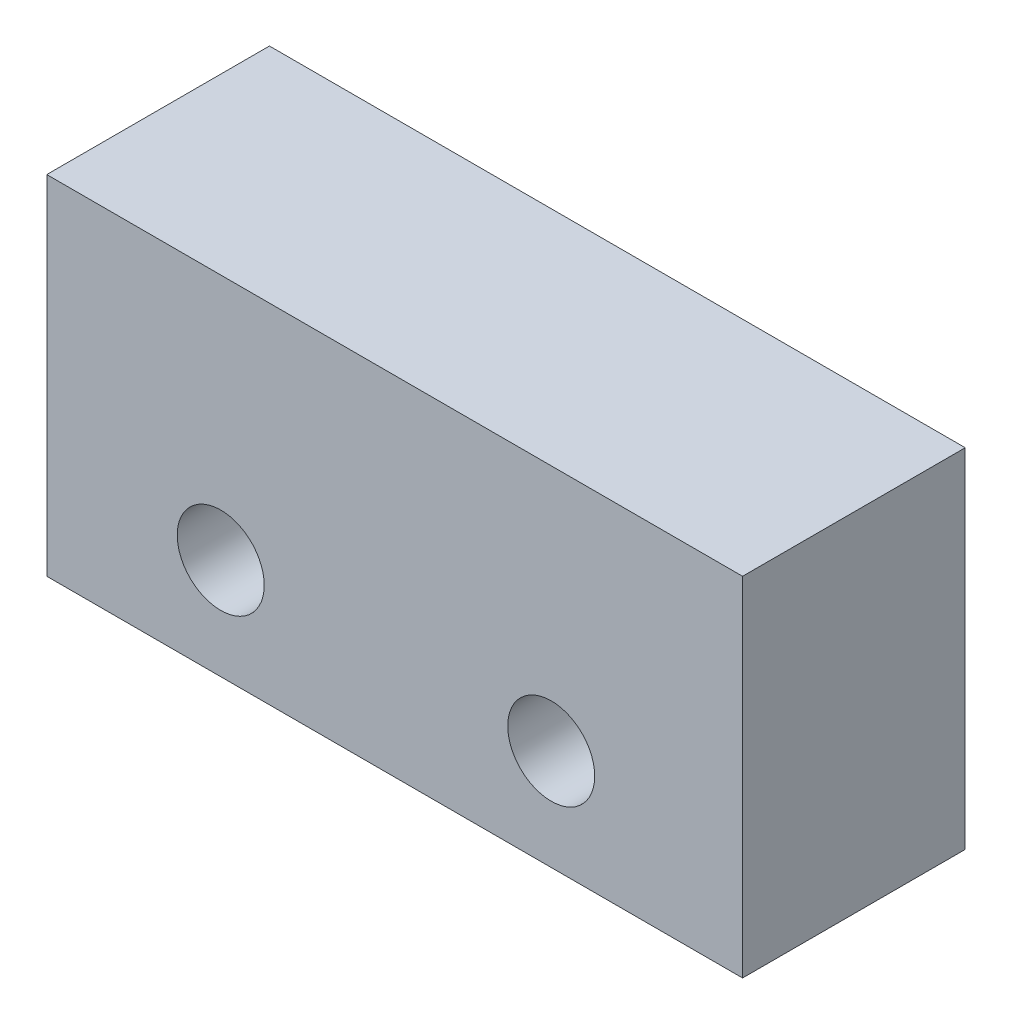
from build123d import *

# Parameters (mm, degrees)
SKETCH1_W           = 20
SKETCH1_H           = 10
SKETCH1_R           = 1.25
BOSS_EXTRUDE1_DEPTH = 6.4


with BuildPart() as part:
    # Sketch1 → Boss-Extrude1 (new body)
    with BuildSketch(Plane.XY):
        Rectangle(SKETCH1_W, SKETCH1_H)
        with Locations((-5, -2.1)):
            Circle(SKETCH1_R, mode=Mode.SUBTRACT)
        with Locations((4.5, -2.1)):
            Circle(SKETCH1_R, mode=Mode.SUBTRACT)
    extrude(amount=BOSS_EXTRUDE1_DEPTH)


solid = part.part
